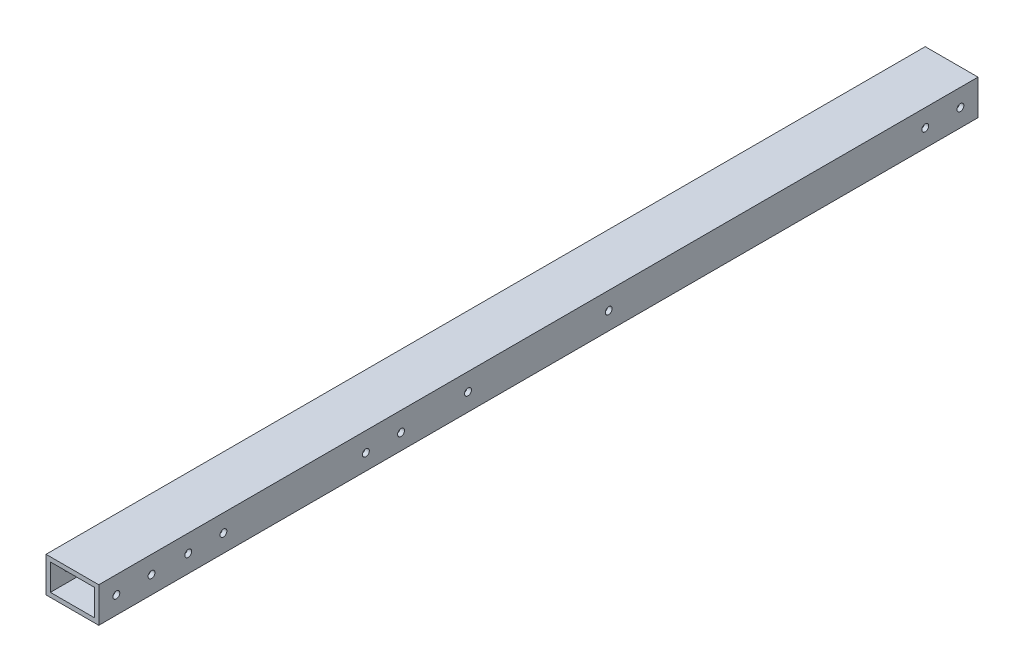
from build123d import *

# Parameters (mm, degrees)
BOSS_EXTRUDE1_DEPTH      = 317.499999
BOSS_EXTRUDE1_DEPTH_BACK = 317.499999
SKETCH3_W                = 38.1
SKETCH3_H                = 25.4
SKETCH3_W_2              = 31.75
SKETCH3_H_2              = 19.05
F_10_CLEARANCE_HOLE2_D   = 4.9784
F_10_CLEARANCE_HOLE5_D   = 4.9784
F_10_CLEARANCE_HOLE4_D   = 4.9784
F_10_CLEARANCE_HOLE3_D   = 4.9784


with BuildPart() as part:
    # Sketch3 → Boss-Extrude1 (new, two sides: drawn at the far end of the back side and taken through both)
    with BuildSketch(Plane.XY.offset(-BOSS_EXTRUDE1_DEPTH_BACK)):
        Rectangle(SKETCH3_W, SKETCH3_H)
        Rectangle(SKETCH3_W_2, SKETCH3_H_2, mode=Mode.SUBTRACT)
    extrude(amount=BOSS_EXTRUDE1_DEPTH + BOSS_EXTRUDE1_DEPTH_BACK)

    # #10 Clearance Hole2 (through all)
    with Locations(Plane.ZY.offset(19.05)):
        with Locations((-304.799999492, 0), (-279.399999492, 0), (279.400000508, 0), (304.800000508, 0)):
            Hole(F_10_CLEARANCE_HOLE2_D / 2)

    # #10 Clearance Hole5 (through all)
    with Locations(Plane(origin=(19.05, 0, 0), x_dir=(0, 0, -1), z_dir=(1, 0, 0))):
        with Locations((-124.587000508, -1.231595708), (-99.187000508, -1.231595708), (-252.857000508, -5.03e-07), (-227.457000508, -5.03e-07)):
            Hole(F_10_CLEARANCE_HOLE5_D / 2)

    # #10 Clearance Hole4 (through all)
    with Locations(Plane(origin=(19.05, 0, 0), x_dir=(0, 0, -1), z_dir=(1, 0, 0))):
        with Locations((-252.857000508, -5.03e-07), (-227.457000508, -5.03e-07)):
            Hole(F_10_CLEARANCE_HOLE4_D / 2)

    # #10 Clearance Hole3 (through all)
    with Locations(Plane.ZY.offset(19.05)):
        with Locations((-50.8, 0), (50.8, 0)):
            Hole(F_10_CLEARANCE_HOLE3_D / 2)


solid = part.part
